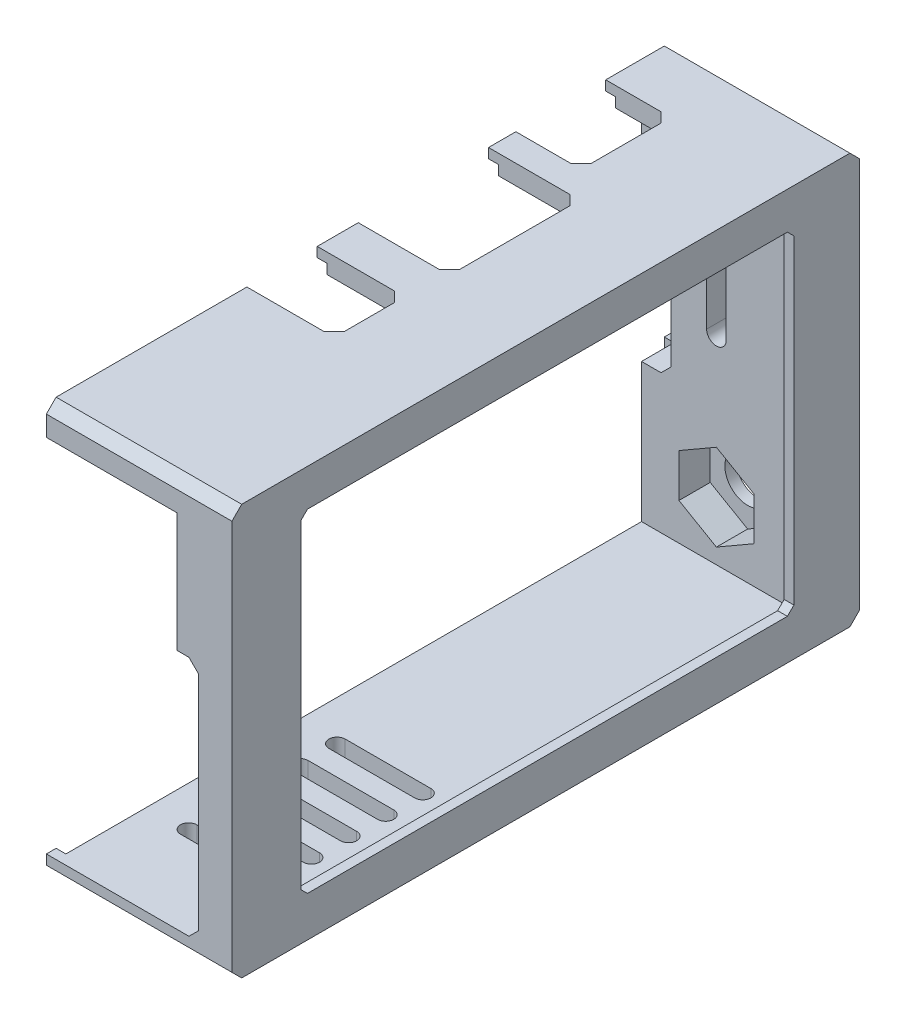
from build123d import *

# Parameters (mm, degrees)
SKETCH2_W           = 86.9
SKETCH2_H           = 57
SKETCH2_W_2         = 75.7
SKETCH2_H_2         = 51.1
BOSS_EXTRUDE2_DEPTH = 1.5
SKETCH2_3_W         = 96.4
SKETCH2_3_H         = 63
SKETCH2_3_W_2       = 86.9
SKETCH2_3_H_2       = 57
BOSS_EXTRUDE3_DEPTH = 27
CHAMFER1_SIZE       = 1
SKETCH3_W           = 96.4
SKETCH3_H           = 63
SKETCH3_W_2         = 93.4
SKETCH3_H_2         = 60
BOSS_EXTRUDE4_DEPTH = 1.5
CHAMFER2_SIZE       = 1.5
SKETCH6_W           = 9.728035046
SKETCH6_H           = 14
CUT_EXTRUDE1_DEPTH  = 6
SKETCH10_W          = 3
SKETCH10_H          = 37.1
CUT_EXTRUDE2_DEPTH  = 23.4
SKETCH11_W          = 3.109966679
SKETCH11_H          = 18.3
CUT_EXTRUDE6_DEPTH  = 20.1
SKETCH12_W          = 13.8
SKETCH12_H          = 3.233091644
CUT_EXTRUDE7_DEPTH  = 10
SKETCH13_W          = 20.000720153
SKETCH13_H          = 4.04568645
CUT_EXTRUDE8_DEPTH  = 14
SKETCH15_W          = 10.8
SKETCH15_H          = 3.606090768
CUT_EXTRUDE9_DEPTH  = 13.4
CHAMFER3_SIZE       = 1.5
CHAMFER4_SIZE       = 1.5
CHAMFER5_SIZE       = 1.5
CHAMFER6_SIZE       = 1.5
CHAMFER7_SIZE       = 1.5
CUT_EXTRUDE11_DEPTH = 4
CUT_EXTRUDE12_DEPTH = 8
CUT_EXTRUDE13_DEPTH = 10
CUT_EXTRUDE14_DEPTH = 4.8


with BuildPart() as part:
    # Sketch2 → Boss-Extrude2 (new body)
    with BuildSketch(Plane(origin=(0, 0, 0), x_dir=(0, 0, -1), z_dir=(1, 0, 0))):
        with Locations((-2.142915598, 3.029012225)):
            Rectangle(SKETCH2_W, SKETCH2_H)
        with Locations((-0.142915598, 3.279012225)):
            Rectangle(SKETCH2_W_2, SKETCH2_H_2, mode=Mode.SUBTRACT)
    extrude(amount=-BOSS_EXTRUDE2_DEPTH)

    # Sketch2<3> → Boss-Extrude3 (add)
    with BuildSketch(Plane(origin=(0, 0, 0), x_dir=(0, 0, -1), z_dir=(1, 0, 0))):
        with Locations((-0.392915598, 3.029012225)):
            Rectangle(SKETCH2_3_W, SKETCH2_3_H)
        with Locations((-2.142915598, 3.029012225)):
            Rectangle(SKETCH2_3_W_2, SKETCH2_3_H_2, mode=Mode.SUBTRACT)
    extrude(amount=-BOSS_EXTRUDE3_DEPTH)

    # Chamfer1
    chamfer1_edges = [part.edges().sort_by_distance(p)[0] for p in [
        (-0.75, -22.270987775, -37.707084402),
        (-0.75, -22.270987775, 37.992915598),
        (-0.75, 28.829012225, 37.992915598),
        (-0.75, 28.829012225, -37.707084402),
    ]]
    chamfer(chamfer1_edges, length=CHAMFER1_SIZE)

    # Sketch3 → Boss-Extrude4 (add)
    with BuildSketch(Plane.ZY.offset(27)):
        with Locations((0.392915598, 3.029012225)):
            Rectangle(SKETCH3_W, SKETCH3_H)
        with Locations((0.392915598, 3.029012225)):
            Rectangle(SKETCH3_W_2, SKETCH3_H_2, mode=Mode.SUBTRACT)
    extrude(amount=BOSS_EXTRUDE4_DEPTH)

    # Chamfer2
    chamfer2_edges = [part.edges().sort_by_distance(p)[0] for p in [
        (-14.25, -28.470987775, 48.592915598),
        (-14.25, 34.529012225, 48.592915598),
        (-14.25, -28.470987775, -47.807084402),
        (-14.25, 34.529012225, -47.807084402),
    ]]
    chamfer(chamfer2_edges, length=CHAMFER2_SIZE)

    # Sketch6 → Cut-Extrude1 (cut)
    with BuildSketch(Plane.ZY.offset(28.5)):
        with Locations((-46.171101925, 2.829012225)):
            Rectangle(SKETCH6_W, SKETCH6_H)
    extrude(amount=-CUT_EXTRUDE1_DEPTH, mode=Mode.SUBTRACT)

    # Sketch10 → Cut-Extrude2 (cut)
    with BuildSketch(Plane.ZY.offset(28.5)):
        with Locations((47.092915598, -6.920987775)):
            Rectangle(SKETCH10_W, SKETCH10_H)
    extrude(amount=-CUT_EXTRUDE2_DEPTH, mode=Mode.SUBTRACT)

    # Sketch11 → Cut-Extrude6 (cut)
    with BuildSketch(Plane.ZY.offset(28.5)):
        with Locations((47.037932259, 20.779012225)):
            Rectangle(SKETCH11_W, SKETCH11_H)
    extrude(amount=-CUT_EXTRUDE6_DEPTH, mode=Mode.SUBTRACT)

    # Sketch12 → Cut-Extrude7 (cut)
    with BuildSketch(Plane.ZY.offset(28.5)):
        with Locations((-30.410119612, 32.912466403)):
            Rectangle(SKETCH12_W, SKETCH12_H)
    extrude(amount=-CUT_EXTRUDE7_DEPTH, mode=Mode.SUBTRACT)

    # Sketch13 → Cut-Extrude8 (cut)
    with BuildSketch(Plane.ZY.offset(28.5)):
        with Locations((-9.312541512, 33.035392559)):
            Rectangle(SKETCH13_W, SKETCH13_H)
    extrude(amount=-CUT_EXTRUDE8_DEPTH, mode=Mode.SUBTRACT)

    # Sketch15 → Cut-Extrude9 (cut)
    with BuildSketch(Plane.ZY.offset(28.5)):
        with Locations((12.393292701, 33.319062827)):
            Rectangle(SKETCH15_W, SKETCH15_H)
    extrude(amount=-CUT_EXTRUDE9_DEPTH, mode=Mode.SUBTRACT)

    # Chamfer3
    chamfer3_edges = [part.edges().sort_by_distance(p)[0] for p in [
        (-18.5, 33.029012225, -37.310119612),
        (-18.5, 33.029012225, -23.510119612),
    ]]
    chamfer(chamfer3_edges, length=CHAMFER3_SIZE)

    # Chamfer4
    chamfer4_edges = [part.edges().sort_by_distance(p)[0] for p in [
        (-14.5, 33.029012225, -19.312901588),
        (-14.5, 33.029012225, 0.687818565),
    ]]
    chamfer(chamfer4_edges, length=CHAMFER4_SIZE)

    # Chamfer5
    chamfer5_edges = [part.edges().sort_by_distance(p)[0] for p in [
        (-15.1, 33.029012225, 6.993292701),
        (-15.1, 33.029012225, 17.793292701),
    ]]
    chamfer(chamfer5_edges, length=CHAMFER5_SIZE)

    # Chamfer6
    chamfer6_edges = [part.edges().sort_by_distance(p)[0] for p in [
        (-22.5, 9.829012225, -44.557084402),
        (-22.5, -4.170987775, -44.557084402),
    ]]
    chamfer(chamfer6_edges, length=CHAMFER6_SIZE)

    # Chamfer7
    chamfer7_edges = [part.edges().sort_by_distance(p)[0] for p in [
        (-5.1, -25.470987775, 47.092915598),
        (-5.1, 11.629012225, 47.092915598),
    ]]
    chamfer(chamfer7_edges, length=CHAMFER7_SIZE)

    # Sketch17 → Cut-Extrude11 (cut)
    with BuildSketch(Plane.XZ.offset(28.470987775)):
        with BuildLine():
            Line((-7.669966397, 35.662637039), (-20.830033603, 35.662637039))
            ThreePointArc((-20.830033603, 35.662637039), (-22.080033603, 34.412637039), (-20.830033603, 33.162637039))
            Line((-20.830033603, 33.162637039), (-7.669966397, 33.162637039))
            ThreePointArc((-7.669966397, 33.162637039), (-6.419966397, 34.412637039), (-7.669966397, 35.662637039))
        make_face()
        with BuildLine():
            Line((-7.669966397, 29.962637039), (-20.830033603, 29.962637039))
            ThreePointArc((-20.830033603, 29.962637039), (-22.080033603, 28.712637039), (-20.830033603, 27.462637039))
            Line((-20.830033603, 27.462637039), (-7.669966397, 27.462637039))
            ThreePointArc((-7.669966397, 27.462637039), (-6.419966397, 28.712637039), (-7.669966397, 29.962637039))
        make_face()
        with BuildLine():
            Line((-7.669966397, 24.262637039), (-20.830033603, 24.262637039))
            ThreePointArc((-20.830033603, 24.262637039), (-22.080033603, 23.012637039), (-20.830033603, 21.762637039))
            Line((-20.830033603, 21.762637039), (-7.669966397, 21.762637039))
            ThreePointArc((-7.669966397, 21.762637039), (-6.419966397, 23.012637039), (-7.669966397, 24.262637039))
        make_face()
        with BuildLine():
            Line((-7.669966397, 18.562637039), (-20.830033603, 18.562637039))
            ThreePointArc((-20.830033603, 18.562637039), (-22.080033603, 17.312637039), (-20.830033603, 16.062637039))
            Line((-20.830033603, 16.062637039), (-7.669966397, 16.062637039))
            ThreePointArc((-7.669966397, 16.062637039), (-6.419966397, 17.312637039), (-7.669966397, 18.562637039))
        make_face()
        with BuildLine():
            Line((-7.669966397, 12.862637039), (-20.830033603, 12.862637039))
            ThreePointArc((-20.830033603, 12.862637039), (-22.080033603, 11.612637039), (-20.830033603, 10.362637039))
            Line((-20.830033603, 10.362637039), (-7.669966397, 10.362637039))
            ThreePointArc((-7.669966397, 10.362637039), (-6.419966397, 11.612637039), (-7.669966397, 12.862637039))
        make_face()
    extrude(amount=-CUT_EXTRUDE11_DEPTH, mode=Mode.SUBTRACT)

    # Sketch18 → Cut-Extrude12 (cut)
    with BuildSketch(Plane(origin=(0, 0, -47.807084402), x_dir=(-1, 0, 0), z_dir=(0, 0, -1))):
        with BuildLine():
            Line((17, 23.129012225), (17, 5.129012225))
            ThreePointArc((17, 5.129012225), (15.5, 3.629012225), (14, 5.129012225))
            Line((14, 5.129012225), (14, 23.129012225))
            ThreePointArc((14, 23.129012225), (15.5, 24.629012225), (17, 23.129012225))
        make_face()
    extrude(amount=-CUT_EXTRUDE12_DEPTH, mode=Mode.SUBTRACT)

    # Sketch19 → Cut-Extrude13 (cut)
    with BuildSketch(Plane(origin=(0, 0, -47.807084402), x_dir=(-1, 0, 0), z_dir=(0, 0, -1))):
        with BuildLine():
            ThreePointArc((19, -16.470987775), (13.025126266, -13.996114041), (15.5, -19.970987775))
            ThreePointArc((15.5, -19.970987775), (17.974873734, -18.945861509), (19, -16.470987775))
        make_face()
    extrude(amount=-CUT_EXTRUDE13_DEPTH, mode=Mode.SUBTRACT)

    # Sketch21 → Cut-Extrude14 (cut)
    with BuildSketch(Plane.XY.offset(-41.307084402)):
        Polygon((-15.5, -23.110987775), (-9.749591319, -19.790987775), (-9.749591319, -13.150987775), (-15.5, -9.830987775), (-21.250408681, -13.150987775), (-21.250408681, -19.790987775), align=None)
    extrude(amount=-CUT_EXTRUDE14_DEPTH, mode=Mode.SUBTRACT)


solid = part.part
